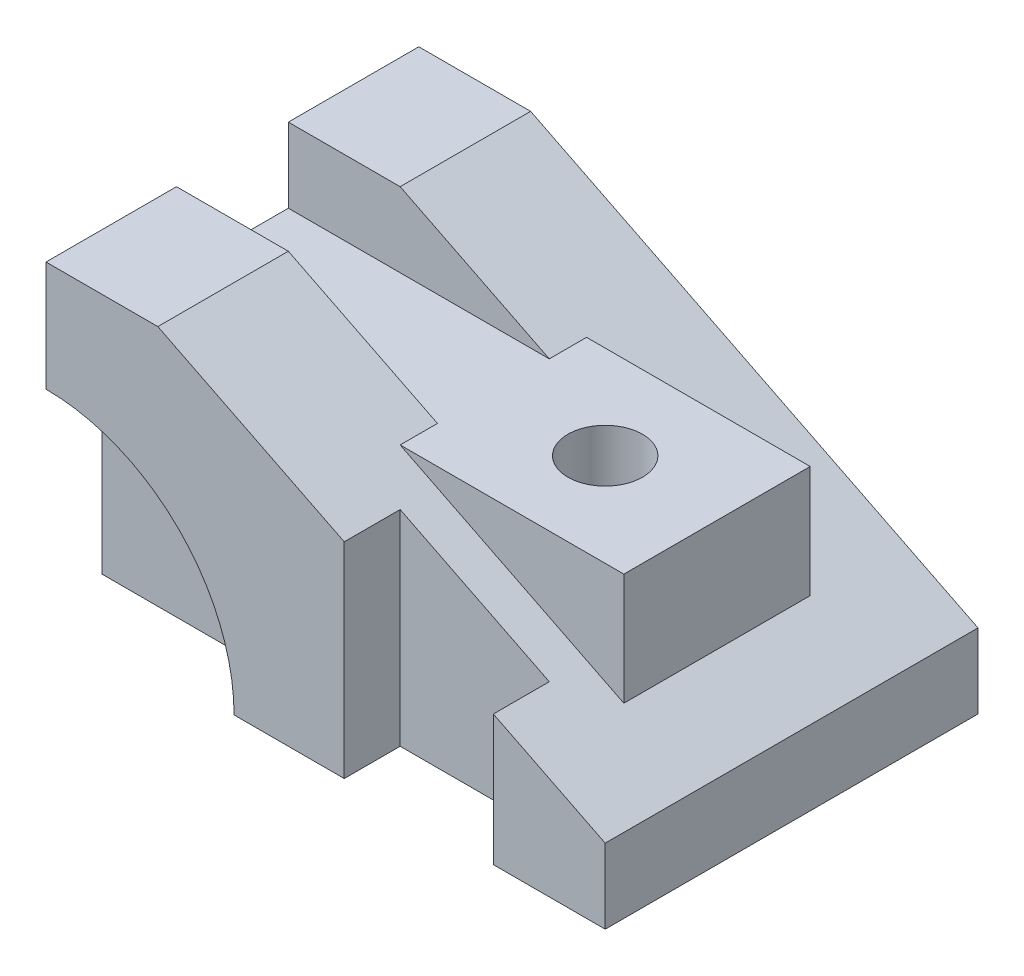
from build123d import *

# Parameters (mm, degrees)
BOSS_EXTRUDE1_DEPTH      = 50
BOSS_EXTRUDE1_DEPTH_BACK = 50
CUT_EXTRUDE2_DEPTH       = 198.230829233
CUT_EXTRUDE2_DEPTH_BACK  = 15
BOSS_EXTRUDE2_DEPTH      = 25
BOSS_EXTRUDE2_DEPTH_BACK = 25
SKETCH8_R                = 10
CUT_EXTRUDE3_DEPTH       = 170.115345253
CUT_EXTRUDE5_REACH       = 179.2
SKETCH11_W               = 30
SKETCH11_H               = 20
CUT_EXTRUDE8_REACH       = 179.2
SKETCH14_W               = 40
SKETCH14_H               = 15


with BuildPart() as part:
    # Sketch1 → Boss-Extrude1 (new, two sides: drawn at the far end of the back side and taken through both)
    with BuildSketch(Plane.XY.offset(-BOSS_EXTRUDE1_DEPTH_BACK)):
        Polygon((0, 0), (0, 80), (30, 80), (150, 20), (150, 0), align=None)
    extrude(amount=BOSS_EXTRUDE1_DEPTH + BOSS_EXTRUDE1_DEPTH_BACK)

    # Sketch6 → Cut-Extrude2 (cut, two sides: drawn at the far end of the back side and taken through both)
    with BuildSketch(Plane.XY.offset(50).offset(-CUT_EXTRUDE2_DEPTH_BACK)):
        with BuildLine():
            Line((-326.513861399, 50.45053136), (0, 50.45053136))
            ThreePointArc((0, 50.45053136), (35.673912839, 35.673912839), (50.45053136, 0))
            Line((50.45053136, 0), (50.45053136, -326.513861399))
            Line((50.45053136, -326.513861399), (-411.309799734, -788.274192493))
            Line((-411.309799734, -788.274192493), (-788.274192493, -411.309799734))
            Line((-788.274192493, -411.309799734), (-326.513861399, 50.45053136))
        make_face()
    extrude(amount=CUT_EXTRUDE2_DEPTH + CUT_EXTRUDE2_DEPTH_BACK, mode=Mode.SUBTRACT)

    # Sketch7 → Boss-Extrude2 (add, two sides: drawn at the far end of the back side and taken through both)
    with BuildSketch(Plane.XY.offset(-BOSS_EXTRUDE2_DEPTH_BACK)):
        Polygon((70, 60), (130, 60), (130, 30), align=None)
    extrude(amount=BOSS_EXTRUDE2_DEPTH + BOSS_EXTRUDE2_DEPTH_BACK)

    # Sketch8 → Cut-Extrude3 (cut, through all)
    with BuildSketch(Plane(origin=(0, 60, 0), x_dir=(1, 0, 0), z_dir=(0, 1, 0))):
        with Locations((100, 0)):
            Circle(SKETCH8_R)
    extrude(amount=-CUT_EXTRUDE3_DEPTH, mode=Mode.SUBTRACT)

    # Sketch11 → Cut-Extrude5 (cut, up to next)
    with BuildSketch(Plane(origin=(0, 0, 0), x_dir=(0, 0, -1), z_dir=(1, 0, 0)), mode=Mode.PRIVATE) as cut_extrude5_sk1:
        with Locations((0, 70)):
            Rectangle(SKETCH11_W, SKETCH11_H)
    cut_extrude5_tool1 = extrude(cut_extrude5_sk1.sketch, amount=CUT_EXTRUDE5_REACH, mode=Mode.PRIVATE) & part.part
    add(cut_extrude5_tool1.solids().sort_by_distance((0, 70, 0))[0], mode=Mode.SUBTRACT)

    # Sketch14 → Cut-Extrude8 (cut, up to next)
    with BuildSketch(Plane.XZ, mode=Mode.PRIVATE) as cut_extrude8_sk1:
        with Locations((100, 42.5)):
            Rectangle(SKETCH14_W, SKETCH14_H)
    cut_extrude8_tool1 = extrude(cut_extrude8_sk1.sketch, amount=-CUT_EXTRUDE8_REACH, mode=Mode.PRIVATE) & part.part
    add(cut_extrude8_tool1.solids().sort_by_distance((100, 0, 42.5))[0], mode=Mode.SUBTRACT)


solid = part.part
